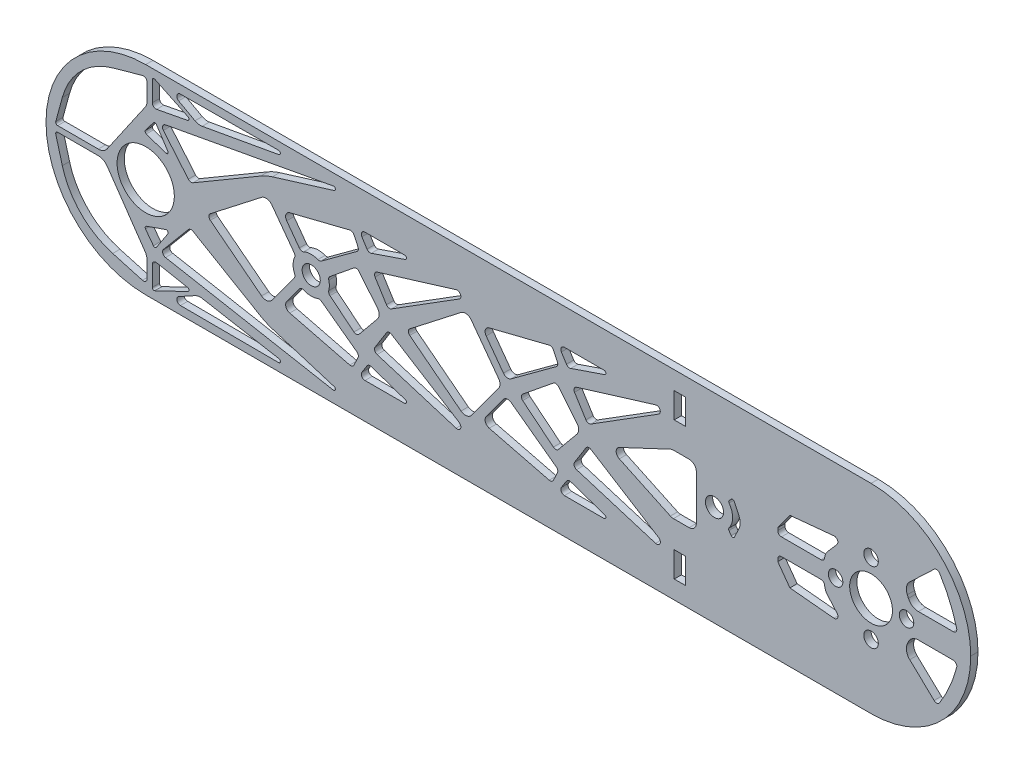
from build123d import *

# Parameters (mm, degrees)
BOSS_EXTRUDE1_DEPTH = 2
SKETCH2_R           = 5.9
SKETCH2_R_2         = 7.9
SKETCH2_R_3         = 2
CUT_EXTRUDE1_DEPTH  = 261.871615934
CUT_EXTRUDE9_DEPTH  = 10
SKETCH8_W           = 3.1
SKETCH8_H           = 7
CUT_EXTRUDE11_DEPTH = 261.871615934
SKETCH9_R           = 5
SKETCH9_R_2         = 2.5
BOSS_EXTRUDE2_DEPTH = 2
FILLET1_R           = 2
FILLET2_R           = 0.5
SKETCH10_R          = 5
SKETCH10_R_2        = 2.5
BOSS_EXTRUDE3_DEPTH = 2
SKETCH11_R          = 2.5
CUT_EXTRUDE12_DEPTH = 261.871615934
FILLET3_R           = 1


with BuildPart() as part:
    # Sketch1 → Boss-Extrude1 (new body)
    with BuildSketch(Plane.XY):
        with BuildLine():
            Line((27.49, 0), (227.51, 0))
            ThreePointArc((227.51, 0), (246.948365415, 8.051634585), (255, 27.49))
            Line((255, 27.49), (255, 27.51))
            ThreePointArc((255, 27.51), (246.948365415, 46.948365415), (227.51, 55))
            Line((227.51, 55), (27.49, 55))
            ThreePointArc((27.49, 55), (8.051634585, 46.948365415), (0, 27.51))
            Line((0, 27.51), (0, 27.49))
            ThreePointArc((0, 27.49), (8.051634585, 8.051634585), (27.49, 0))
        make_face()
    extrude(amount=BOSS_EXTRUDE1_DEPTH)

    # Sketch2 → Cut-Extrude1 (cut, through all)
    with BuildSketch(Plane.XY.offset(2)):
        with Locations((227.51, 27.51)):
            Circle(SKETCH2_R)
        with Locations((27.49, 27.51)):
            Circle(SKETCH2_R_2)
        with Locations((217.73, 27.51)):
            Circle(SKETCH2_R_3)
        with Locations((227.51, 37.29)):
            Circle(SKETCH2_R_3)
        with Locations((237.29, 27.51)):
            Circle(SKETCH2_R_3)
        with Locations((227.51, 17.73)):
            Circle(SKETCH2_R_3)
    extrude(amount=-CUT_EXTRUDE1_DEPTH, mode=Mode.SUBTRACT)

    # Sketch7 → Cut-Extrude9 (cut)
    with BuildSketch(Plane.XY.offset(2)):
        with BuildLine():
            ThreePointArc((62.276351273, 38.867983515), (60.941024034, 39.661165833), (59.440705341, 39.259567968))
            Line((59.440705341, 39.259567968), (45.30720418, 28.283402005))
            ThreePointArc((45.30720418, 28.283402005), (44.920568138, 27.493523182), (45.307328077, 26.703705017))
            Line((45.307328077, 26.703705017), (59.442550816, 15.729756209))
            ThreePointArc((59.442550816, 15.729756209), (60.942932486, 15.328393693), (62.278135288, 16.121785464))
            Line((62.278135288, 16.121785464), (69.796805068, 26.307584119))
            ThreePointArc((69.796805068, 26.307584119), (70.087489517, 26.870206079), (70.187700705, 27.495504918))
            ThreePointArc((70.187700705, 27.495504918), (70.087391433, 28.120788029), (69.796618732, 28.683364385))
            Line((69.796618732, 28.683364385), (62.276351273, 38.867983515))
        make_face()
        with BuildLine():
            ThreePointArc((67.212342147, 39.473819008), (66.165636786, 38.527519849), (66.367628572, 37.130997909))
            Line((66.367628572, 37.130997909), (71.140085865, 30.631053347))
            ThreePointArc((71.140085865, 30.631053347), (72.121954684, 30.036113764), (73.236926598, 30.309714051))
            Line((73.236926598, 30.309714051), (85.718164357, 39.473819008))
            ThreePointArc((85.718164357, 39.473819008), (86.095947145, 40.035249405), (86.029719293, 40.708701555))
            Line((86.029719293, 40.708701555), (84.905853192, 43.076319626))
            ThreePointArc((84.905853192, 43.076319626), (84.429414656, 43.551772221), (83.759546818, 43.617544008))
            Line((83.759546818, 43.617544008), (67.212342147, 39.473819008))
        make_face()
        with BuildLine():
            ThreePointArc((87.947700457, 45.203423243), (87.07114708, 44.684727903), (87.103922006, 43.666731595))
            Line((87.103922006, 43.666731595), (88.52019513, 41.440088517))
            ThreePointArc((88.52019513, 41.440088517), (89.032719409, 41.033238607), (89.687089371, 41.030420727))
            Line((89.687089371, 41.030420727), (99.058907767, 44.230243524))
            ThreePointArc((99.058907767, 44.230243524), (99.390599231, 44.785307736), (98.897349872, 45.203423243))
            Line((98.897349872, 45.203423243), (87.947700457, 45.203423243))
        make_face()
        with BuildLine():
            ThreePointArc((91.296117336, 37.341416184), (90.65240427, 36.734224881), (90.742570386, 35.85393069))
            Line((90.742570386, 35.85393069), (93.883244025, 30.84892834))
            ThreePointArc((93.883244025, 30.84892834), (94.506944957, 30.405713182), (95.261399577, 30.53315241))
            Line((95.261399577, 30.53315241), (113.926202682, 42.232795614))
            ThreePointArc((113.926202682, 42.232795614), (114.304514479, 43.49596505), (113.10159408, 44.036057039))
            Line((113.10159408, 44.036057039), (91.296117336, 37.341416184))
        make_face()
        with BuildLine():
            Line((172.574115867, 35.67556404), (158.085302757, 28.859766004))
            ThreePointArc((158.085302757, 28.859766004), (157.223809105, 27.502331279), (158.085515678, 26.145031707))
            Line((158.085515678, 26.145031707), (172.575397754, 19.33150651))
            Line((172.575397754, 19.33150651), (187.912448626, 19.333912322))
            Line((187.912448626, 19.333912322), (191.003773314, 25.773662207))
            ThreePointArc((191.003773314, 25.773662207), (191.397734538, 27.505011587), (191.003501734, 29.236299148))
            Line((191.003501734, 29.236299148), (187.911166927, 35.67556404))
            Line((187.911166927, 35.67556404), (172.574115867, 35.67556404))
        make_face()
        with BuildLine():
            Line((84.908988076, 35.145171993), (76.447969001, 28.272232949))
            ThreePointArc((76.447969001, 28.272232949), (76.07847106, 27.495966939), (76.448090764, 26.719758898))
            Line((76.448090764, 26.719758898), (84.910187843, 19.848147158))
            ThreePointArc((84.910187843, 19.848147158), (85.641321603, 19.629522207), (86.313781235, 19.99028735))
            Line((86.313781235, 19.99028735), (91.43022639, 26.228757151))
            ThreePointArc((91.43022639, 26.228757151), (91.883800187, 27.497206573), (91.430027424, 28.76558483))
            Line((91.430027424, 28.76558483), (86.312603747, 35.003251974))
            ThreePointArc((86.312603747, 35.003251974), (85.640087533, 35.363911629), (84.908988076, 35.145171993))
        make_face()
        with BuildLine():
            Line((91.297661533, 17.652904897), (113.104188149, 10.961684591))
            ThreePointArc((113.104188149, 10.961684591), (114.307023812, 11.501965266), (113.928513876, 12.765075344))
            Line((113.928513876, 12.765075344), (95.261875762, 24.461790592))
            ThreePointArc((95.261875762, 24.461790592), (94.507401161, 24.589111473), (93.883769761, 24.145798484))
            Line((93.883769761, 24.145798484), (90.743881259, 19.140303541))
            ThreePointArc((90.743881259, 19.140303541), (90.653853229, 18.259995218), (91.297661533, 17.652904897))
        make_face()
        with BuildLine():
            Line((87.950477951, 9.790372693), (98.900127232, 9.792090285))
            ThreePointArc((98.900127232, 9.792090285), (99.393310998, 10.210283159), (99.061532469, 10.765295334))
            Line((99.061532469, 10.765295334), (89.689212255, 13.963648002))
            ThreePointArc((89.689212255, 13.963648002), (89.034842744, 13.960727477), (88.52238229, 13.553797175))
            Line((88.52238229, 13.553797175), (87.106458461, 11.326931964))
            ThreePointArc((87.106458461, 11.326931964), (87.073843221, 10.308930527), (87.950477951, 9.790372693))
        make_face()
        with BuildLine():
            Line((67.214221134, 15.516724252), (83.762075598, 11.375594943))
            ThreePointArc((83.762075598, 11.375594943), (84.431933111, 11.441471806), (84.90829706, 11.916999131))
            Line((84.90829706, 11.916999131), (86.031791756, 14.284793466))
            ThreePointArc((86.031791756, 14.284793466), (86.097913968, 14.958255996), (85.720043117, 15.519627126))
            Line((85.720043117, 15.519627126), (73.237368005, 24.681774129))
            ThreePointArc((73.237368005, 24.681774129), (72.122353188, 24.955199515), (71.140577704, 24.360105921))
            Line((71.140577704, 24.360105921), (66.369140068, 17.859412818))
            ThreePointArc((66.369140068, 17.859412818), (66.167367348, 16.46285921), (67.214221134, 15.516724252))
        make_face()
        with BuildLine():
            ThreePointArc((32.954432241, 43.333957694), (32.194839442, 42.688818562), (32.369887042, 41.707725264))
            Line((32.369887042, 41.707725264), (39.256590365, 33.501484201))
            ThreePointArc((39.256590365, 33.501484201), (39.852383726, 33.158910881), (40.528572692, 33.28177133))
            Line((40.528572692, 33.28177133), (59.238191415, 44.256982312))
            ThreePointArc((59.238191415, 44.256982312), (60.785594168, 45.047986899), (62.414101214, 45.654706223))
            Line((62.414101214, 45.654706223), (79.452573655, 50.900509093))
            ThreePointArc((79.452573655, 50.900509093), (79.791049931, 51.497501853), (79.214718751, 51.87007254))
            Line((79.214718751, 51.87007254), (32.954432241, 43.333957694))
        make_face()
        with BuildLine():
            ThreePointArc((30.441537781, 42.160185987), (30.039442356, 42.38477669), (29.624303161, 42.185324533))
            Line((29.624303161, 42.185324533), (27.43911543, 39.276463724))
            ThreePointArc((27.43911543, 39.276463724), (27.360271579, 38.831471917), (27.672421639, 38.504674731))
            Line((27.672421639, 38.504674731), (33.019290902, 36.616907375))
            ThreePointArc((33.019290902, 36.616907375), (33.579607516, 36.780363849), (33.603219313, 37.363557822))
            Line((33.603219313, 37.363557822), (30.441537781, 42.160185987))
        make_face()
        with BuildLine():
            Line((30.443838612, 12.824589337), (33.604767693, 17.621713393))
            ThreePointArc((33.604767693, 17.621713393), (33.581064415, 18.204903655), (33.020722167, 18.368272234))
            Line((33.020722167, 18.368272234), (27.674149091, 16.479666177))
            ThreePointArc((27.674149091, 16.479666177), (27.362050297, 16.15282003), (27.44096395, 15.707840596))
            Line((27.44096395, 15.707840596), (29.626607945, 12.799322597))
            ThreePointArc((29.626607945, 12.799322597), (30.041778422, 12.599935562), (30.443838612, 12.824589337))
        make_face()
        with BuildLine():
            Line((32.956917162, 11.651211824), (79.218542101, 3.122353598))
            ThreePointArc((79.218542101, 3.122353598), (79.794814832, 3.495014685), (79.456244914, 4.091954344))
            Line((79.456244914, 4.091954344), (62.416949812, 9.335084448))
            ThreePointArc((62.416949812, 9.335084448), (60.788347615, 9.941548312), (59.240820801, 10.73231016))
            Line((59.240820801, 10.73231016), (40.529480707, 21.704586164))
            ThreePointArc((40.529480707, 21.704586164), (39.853272476, 21.827340543), (39.25753286, 21.484673769))
            Line((39.25753286, 21.484673769), (32.372116875, 13.27735254))
            ThreePointArc((32.372116875, 13.27735254), (32.197223175, 12.296231796), (32.956917162, 11.651211824))
        make_face()
        with BuildLine():
            Line((36.571124609, 50.862644907), (41.079460515, 48.37446436))
            ThreePointArc((41.079460515, 48.37446436), (42.041431883, 48.040890106), (43.059570466, 48.048274075))
            Line((43.059570466, 48.048274075), (64.227164969, 51.851420922))
            ThreePointArc((64.227164969, 51.851420922), (64.636685308, 52.388895232), (64.136799117, 52.843537221))
            Line((64.136799117, 52.843537221), (37.065223096, 52.738095605))
            ThreePointArc((37.065223096, 52.738095605), (36.087320861, 51.992917764), (36.571124609, 50.862644907))
        make_face()
        with BuildLine():
            ThreePointArc((2.692277784, 28.990320761), (2.787770382, 28.503308349), (3.232676131, 28.283402005))
            Line((3.232676131, 28.283402005), (14.416168766, 28.283402005))
            ThreePointArc((14.416168766, 28.283402005), (15.811684223, 28.627740767), (16.886846303, 29.581710933))
            Line((16.886846303, 29.581710933), (27.329476727, 44.743318615))
            ThreePointArc((27.329476727, 44.743318615), (27.723413702, 45.553952061), (27.858799189, 46.445009687))
            Line((27.858799189, 46.445009687), (27.858799189, 50.982234381))
            ThreePointArc((27.858799189, 50.982234381), (27.462783351, 51.7792307), (26.588392925, 51.944980688))
            Line((26.588392925, 51.944980688), (18.38978393, 49.642239853))
            ThreePointArc((18.38978393, 49.642239853), (9.596650896, 44.47007842), (4.498345957, 35.6339181))
            Line((4.498345957, 35.6339181), (2.692277784, 28.990320761))
        make_face()
        with BuildLine():
            ThreePointArc((30.020439162, 52.740145749), (29.537910445, 52.712395691), (29.304306416, 52.289272557))
            Line((29.304306416, 52.289272557), (29.304306416, 46.792302906))
            ThreePointArc((29.304306416, 46.792302906), (29.666812089, 46.021847856), (30.491508383, 45.80998146))
            Line((30.491508383, 45.80998146), (39.00512846, 47.432430445))
            ThreePointArc((39.00512846, 47.432430445), (39.407350751, 47.859098691), (39.127660223, 48.37446436))
            Line((39.127660223, 48.37446436), (30.020439162, 52.740145749))
        make_face()
        with BuildLine():
            Line((30.0243996, 2.24456365), (39.130935736, 6.611673569))
            ThreePointArc((39.130935736, 6.611673569), (39.410545419, 7.127083105), (39.008256204, 7.553688252))
            Line((39.008256204, 7.553688252), (30.494381731, 9.174801747))
            ThreePointArc((30.494381731, 9.174801747), (29.669718681, 8.962805989), (29.307333867, 8.192294085))
            Line((29.307333867, 8.192294085), (29.308196137, 2.695324502))
            ThreePointArc((29.308196137, 2.695324502), (29.541866536, 2.272238017), (30.0243996, 2.24456365))
        make_face()
        with BuildLine():
            ThreePointArc((4.499623379, 19.346787623), (9.59931432, 10.511427146), (18.393258565, 5.340645091))
            Line((18.393258565, 5.340645091), (26.592228673, 3.039190341))
            ThreePointArc((26.592228673, 3.039190341), (27.466593089, 3.205077487), (27.862483903, 4.002135916))
            Line((27.862483903, 4.002135916), (27.861772181, 8.539360554))
            ThreePointArc((27.861772181, 8.539360554), (27.726246922, 9.430396932), (27.332182794, 10.240968574))
            Line((27.332182794, 10.240968574), (16.887174207, 25.40093801))
            ThreePointArc((16.887174207, 25.40093801), (15.811862498, 26.354739511), (14.416293043, 26.698859365))
            Line((14.416293043, 26.698859365), (3.232800546, 26.697105092))
            ThreePointArc((3.232800546, 26.697105092), (2.787929298, 26.477128961), (2.692513095, 25.990101575))
            Line((2.692513095, 25.990101575), (4.499623379, 19.346787623))
        make_face()
        with BuildLine():
            ThreePointArc((64.140775353, 2.146523765), (64.640590222, 2.601244162), (64.230985578, 3.138654228))
            Line((64.230985578, 3.138654228), (43.062794763, 6.93848062))
            ThreePointArc((43.062794763, 6.93848062), (42.044655035, 6.945704881), (41.082736004, 6.611979734))
            Line((41.082736004, 6.611979734), (36.574790456, 4.123092027))
            ThreePointArc((36.574790456, 4.123092027), (36.091164012, 2.992743294), (37.069183125, 2.247718858))
            Line((37.069183125, 2.247718858), (64.140775353, 2.146523765))
        make_face()
        with BuildLine():
            Line((201.792251964, 24.152249252), (201.792398569, 23.447977599))
            Line((201.792398569, 23.447977599), (205.130453713, 18.838940263))
            Line((205.130453713, 18.838940263), (217.262691237, 17.67079889))
            ThreePointArc((217.262691237, 17.67079889), (218.247840604, 18.208887816), (218.112408807, 19.323211466))
            Line((218.112408807, 19.323211466), (215.461977438, 22.364383642))
            ThreePointArc((215.461977438, 22.364383642), (214.99813458, 23.081718105), (214.755272748, 23.900703489))
            Line((214.755272748, 23.900703489), (214.696928624, 24.2990789))
            ThreePointArc((214.696928624, 24.2990789), (214.361293861, 24.910828217), (213.707326817, 25.154169597))
            Line((213.707326817, 25.154169597), (202.792095079, 25.152457404))
            ThreePointArc((202.792095079, 25.152457404), (202.085016116, 24.859435129), (201.792251964, 24.152249252))
        make_face()
        with BuildLine():
            ThreePointArc((117.276351093, 38.87229724), (115.941023854, 39.665479559), (114.440705161, 39.263881693))
            Line((114.440705161, 39.263881693), (100.307204, 28.28771573))
            ThreePointArc((100.307204, 28.28771573), (99.920567958, 27.497836907), (100.307327898, 26.708018743))
            Line((100.307327898, 26.708018743), (114.442550637, 15.734069935))
            ThreePointArc((114.442550637, 15.734069935), (115.942932307, 15.332707418), (117.278135109, 16.12609919))
            Line((117.278135109, 16.12609919), (124.796804888, 26.311897844))
            ThreePointArc((124.796804888, 26.311897844), (125.087489338, 26.874519805), (125.187700525, 27.499818643))
            ThreePointArc((125.187700525, 27.499818643), (125.087391253, 28.125101755), (124.796618553, 28.68767811))
            Line((124.796618553, 28.68767811), (117.276351093, 38.87229724))
        make_face()
        with BuildLine():
            Line((205.12909416, 36.173236956), (201.791762043, 31.563676061))
            Line((201.791762043, 31.563676061), (201.791725912, 30.859404394))
            ThreePointArc((201.791725912, 30.859404394), (202.084600992, 30.152264449), (202.791725911, 29.859353092))
            Line((202.791725911, 29.859353092), (213.706957783, 29.859353092))
            ThreePointArc((213.706957783, 29.859353092), (214.360886648, 30.102797052), (214.696425446, 30.714599011))
            Line((214.696425446, 30.714599011), (214.754707079, 31.112983568))
            ThreePointArc((214.754707079, 31.112983568), (214.997440439, 31.932007038), (215.461170769, 32.649414252))
            Line((215.461170769, 32.649414252), (218.111125059, 35.691002145))
            ThreePointArc((218.111125059, 35.691002145), (218.246382058, 36.805347025), (217.261148297, 37.343281411))
            Line((217.261148297, 37.343281411), (205.12909416, 36.173236956))
        make_face()
        with BuildLine():
            ThreePointArc((238.175642944, 36.795036764), (237.297392994, 35.203920398), (237.498921205, 33.397719787))
            Line((237.498921205, 33.397719787), (237.813061911, 32.692096589))
            ThreePointArc((237.813061911, 32.692096589), (238.919780151, 31.396242524), (240.553731451, 30.912232021))
            Line((240.553731451, 30.912232021), (250.157550257, 30.912232021))
            ThreePointArc((250.157550257, 30.912232021), (250.950943948, 31.303523182), (251.123441762, 32.17117912))
            Line((251.123441762, 32.17117912), (251.121981873, 32.176624614))
            ThreePointArc((251.121981873, 32.176624614), (249.172689753, 37.759581174), (246.421590834, 42.99413927))
            ThreePointArc((246.421590834, 42.99413927), (245.70110355, 43.436588252), (244.899124214, 43.168834309))
            Line((244.899124214, 43.168834309), (238.175642944, 36.795036764))
        make_face()
        with BuildLine():
            Line((238.177099627, 18.222324236), (244.901580626, 11.849581432))
            ThreePointArc((244.901580626, 11.849581432), (245.703601952, 11.581953293), (246.424019824, 12.024515287))
            ThreePointArc((246.424019824, 12.024515287), (249.174297602, 17.259504864), (251.12271394, 22.842767127))
            Line((251.12271394, 22.842767127), (251.124172975, 22.84821285))
            ThreePointArc((251.124172975, 22.84821285), (250.95153906, 23.715841718), (250.158084, 24.107008421))
            Line((250.158084, 24.107008421), (240.554265313, 24.105501939))
            ThreePointArc((240.554265313, 24.105501939), (238.920389956, 23.621235136), (237.813875001, 22.325207484))
            Line((237.813875001, 22.325207484), (237.499844984, 21.619535018))
            ThreePointArc((237.499844984, 21.619535018), (237.298600101, 19.813302817), (238.177099627, 18.222324236))
        make_face()
        with BuildLine():
            ThreePointArc((122.212341967, 39.478132733), (121.165636607, 38.531833574), (121.367628392, 37.135311634))
            Line((121.367628392, 37.135311634), (126.140085686, 30.635367072))
            ThreePointArc((126.140085686, 30.635367072), (127.121954505, 30.04042749), (128.236926418, 30.314027777))
            Line((128.236926418, 30.314027777), (140.718164177, 39.478132733))
            ThreePointArc((140.718164177, 39.478132733), (141.095946966, 40.03956313), (141.029719113, 40.71301528))
            Line((141.029719113, 40.71301528), (139.905853013, 43.080633351))
            ThreePointArc((139.905853013, 43.080633351), (139.429414476, 43.556085946), (138.759546638, 43.621857733))
            Line((138.759546638, 43.621857733), (122.212341967, 39.478132733))
        make_face()
        with BuildLine():
            ThreePointArc((142.947700278, 45.207736968), (142.0711469, 44.689041629), (142.103921827, 43.67104532))
            Line((142.103921827, 43.67104532), (143.52019495, 41.444402243))
            ThreePointArc((143.52019495, 41.444402243), (144.03271923, 41.037552332), (144.687089192, 41.034734453))
            Line((144.687089192, 41.034734453), (154.058907588, 44.234557249))
            ThreePointArc((154.058907588, 44.234557249), (154.390599051, 44.789621462), (153.897349693, 45.207736968))
            Line((153.897349693, 45.207736968), (142.947700278, 45.207736968))
        make_face()
        with BuildLine():
            ThreePointArc((146.296117156, 37.34572991), (145.65240409, 36.738538606), (145.742570207, 35.858244416))
            Line((145.742570207, 35.858244416), (148.883243846, 30.853242066))
            ThreePointArc((148.883243846, 30.853242066), (149.506944778, 30.410026907), (150.261399397, 30.537466135))
            Line((150.261399397, 30.537466135), (168.926202503, 42.23710934))
            ThreePointArc((168.926202503, 42.23710934), (169.304514299, 43.500278776), (168.101593901, 44.040370764))
            Line((168.101593901, 44.040370764), (146.296117156, 37.34572991))
        make_face()
        with BuildLine():
            Line((139.908987897, 35.149485719), (131.447968822, 28.276546675))
            ThreePointArc((131.447968822, 28.276546675), (131.07847088, 27.500280664), (131.448090584, 26.724072624))
            Line((131.448090584, 26.724072624), (139.910187664, 19.852460883))
            ThreePointArc((139.910187664, 19.852460883), (140.641321424, 19.633835933), (141.313781055, 19.994601076))
            Line((141.313781055, 19.994601076), (146.430226211, 26.233070876))
            ThreePointArc((146.430226211, 26.233070876), (146.883800007, 27.501520298), (146.430027244, 28.769898555))
            Line((146.430027244, 28.769898555), (141.312603568, 35.0075657))
            ThreePointArc((141.312603568, 35.0075657), (140.640087354, 35.368225354), (139.908987897, 35.149485719))
        make_face()
        with BuildLine():
            Line((146.297661353, 17.657218622), (168.104187969, 10.965998317))
            ThreePointArc((168.104187969, 10.965998317), (169.307023633, 11.506278992), (168.928513696, 12.769389069))
            Line((168.928513696, 12.769389069), (150.261875582, 24.466104318))
            ThreePointArc((150.261875582, 24.466104318), (149.507400982, 24.593425198), (148.883769582, 24.15011221))
            Line((148.883769582, 24.15011221), (145.743881079, 19.144617267))
            ThreePointArc((145.743881079, 19.144617267), (145.653853049, 18.264308943), (146.297661353, 17.657218622))
        make_face()
        with BuildLine():
            Line((142.950477772, 9.794686418), (153.900127052, 9.79640401))
            ThreePointArc((153.900127052, 9.79640401), (154.393310818, 10.214596884), (154.06153229, 10.76960906))
            Line((154.06153229, 10.76960906), (144.689212076, 13.967961728))
            ThreePointArc((144.689212076, 13.967961728), (144.034842564, 13.965041202), (143.522382111, 13.5581109))
            Line((143.522382111, 13.5581109), (142.106458281, 11.33124569))
            ThreePointArc((142.106458281, 11.33124569), (142.073843041, 10.313244253), (142.950477772, 9.794686418))
        make_face()
        with BuildLine():
            Line((122.214220955, 15.521037978), (138.762075418, 11.379908668))
            ThreePointArc((138.762075418, 11.379908668), (139.431932931, 11.445785532), (139.908296881, 11.921312857))
            Line((139.908296881, 11.921312857), (141.031791577, 14.289107191))
            ThreePointArc((141.031791577, 14.289107191), (141.097913789, 14.962569721), (140.720042937, 15.523940852))
            Line((140.720042937, 15.523940852), (128.237367825, 24.686087854))
            ThreePointArc((128.237367825, 24.686087854), (127.122353008, 24.95951324), (126.140577525, 24.364419646))
            Line((126.140577525, 24.364419646), (121.369139889, 17.863726543))
            ThreePointArc((121.369139889, 17.863726543), (121.167367168, 16.467172936), (122.214220955, 15.521037978))
        make_face()
    extrude(amount=-CUT_EXTRUDE9_DEPTH, mode=Mode.SUBTRACT)

    # Sketch8 → Cut-Extrude11 (cut, through all)
    with BuildSketch(Plane.XY.offset(2)):
        with Locations((174.784876121, 46.51)):
            Rectangle(SKETCH8_W, SKETCH8_H)
        with Locations((174.784876121, 8.51)):
            Rectangle(SKETCH8_W, SKETCH8_H)
    extrude(amount=-CUT_EXTRUDE11_DEPTH, mode=Mode.SUBTRACT)

    # Sketch9 → Boss-Extrude2 (add)
    # profile 1 of 3: a face of its own
    with BuildSketch(Plane.XY.offset(2)):
        with BuildLine():
            Line((179.334876121, 35.67556404), (179.334876121, 27.737826136))
            ThreePointArc((179.334876121, 27.737826136), (182.57498862, 32.417868442), (188.095994515, 31.032365319))
            Line((188.095994515, 31.032365319), (189.457334331, 32.455931594))
            Line((189.457334331, 32.455931594), (187.911166927, 35.67556404))
            Line((187.911166927, 35.67556404), (179.334876121, 35.67556404))
        make_face()
    # profile 2 of 3: a face of its own
    with BuildSketch(Plane.XY.offset(2)):
        with Locations((184.334876121, 27.737826136)):
            Circle(SKETCH9_R)
        with Locations((184.334876121, 27.737826136)):
            Circle(SKETCH9_R_2, mode=Mode.SUBTRACT)
    # profile 3 of 3: a face of its own
    with BuildSketch(Plane.XY.offset(2)):
        with BuildLine():
            ThreePointArc((188.095994515, 24.443286953), (182.57498862, 23.057783831), (179.334876121, 27.737826136))
            Line((179.334876121, 27.737826136), (179.334876121, 19.332566821))
            Line((179.334876121, 19.332566821), (187.912448626, 19.333912322))
            Line((187.912448626, 19.333912322), (189.45811097, 22.553787265))
            Line((189.45811097, 22.553787265), (188.095994515, 24.443286953))
        make_face()
    extrude(amount=-BOSS_EXTRUDE2_DEPTH)

    # Fillet1
    fillet1_edges = [part.edges().sort_by_distance(p)[0] for p in [
        (179.334876121, 19.332566821, 1),
        (179.334876121, 35.67556404, 1),
        (172.575397754, 19.33150651, 1),
        (172.574115867, 35.67556404, 1),
    ]]
    fillet(fillet1_edges, radius=FILLET1_R)

    # Fillet2
    fillet2_edges = [part.edges().sort_by_distance(p)[0] for p in [
        (189.457334331, 32.455931594, 1),
        (188.095994515, 31.032365319, 1),
        (188.095994515, 24.443286953, 1),
        (189.45811097, 22.553787265, 1),
    ]]
    fillet(fillet2_edges, radius=FILLET2_R)

    # Sketch10 → Boss-Extrude3 (add)
    with BuildSketch(Plane.XY.offset(2)):
        with Locations((73.133085882, 27.51)):
            Circle(SKETCH10_R)
        with Locations((73.133085882, 27.51)):
            Circle(SKETCH10_R_2, mode=Mode.SUBTRACT)
    extrude(amount=-BOSS_EXTRUDE3_DEPTH)

    # Sketch11 → Cut-Extrude12 (cut, through all)
    with BuildSketch(Plane.XY.offset(2)):
        with Locations((73.133085882, 27.51)):
            Circle(SKETCH11_R)
    extrude(amount=-CUT_EXTRUDE12_DEPTH, mode=Mode.SUBTRACT)

    # Fillet3
    fillet3_edges = [part.edges().sort_by_distance(p)[0] for p in [
        (75.454906041, 31.938222121, 1),
        (68.818837124, 24.982697555, 1),
        (68.809146773, 30.020687273, 1),
        (70.371339031, 31.678063619, 1),
        (77.772087029, 25.644613081, 1),
        (77.780401174, 29.354575989, 1),
        (70.386100746, 23.33219284, 1),
        (75.432874863, 23.070296108, 1),
    ]]
    fillet(fillet3_edges, radius=FILLET3_R)


solid = part.part
